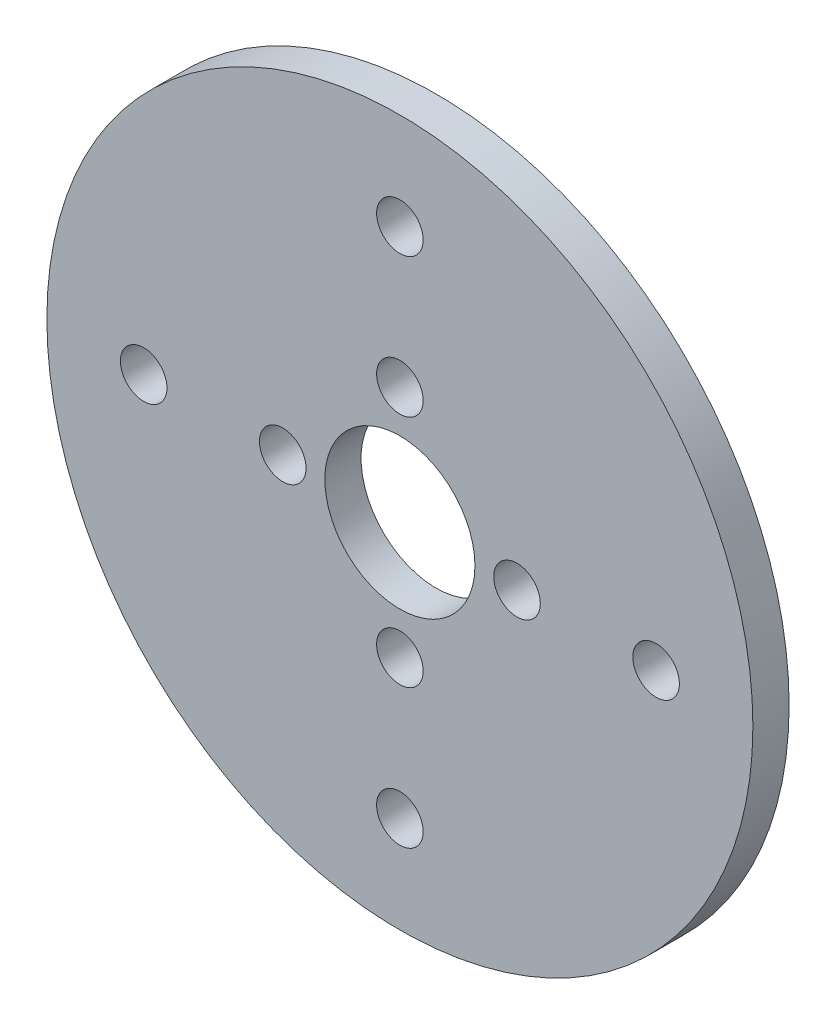
from build123d import *

# Parameters (mm, degrees)
SKETCH1_R           = 34.1
BOSS_EXTRUDE1_DEPTH = 1.75
SKETCH3_R           = 2.25
CUT_EXTRUDE2_DEPTH  = 49.351525312
SKETCH2_R           = 7.25
CUT_EXTRUDE1_DEPTH  = 49.351525312


with BuildPart() as part:
    # Sketch1 → Boss-Extrude1 (new, symmetric)
    with BuildSketch(Plane.XY):
        Circle(SKETCH1_R)
    extrude(amount=BOSS_EXTRUDE1_DEPTH, both=True)

    # Sketch3 → Cut-Extrude2 (cut, through all)
    with BuildSketch(Plane.XY.offset(1.75)):
        with Locations((0, 24.75)):
            Circle(SKETCH3_R)
        with Locations((0, 11.3137085)):
            Circle(SKETCH3_R)
        with Locations((24.75, 0)):
            Circle(SKETCH3_R)
        with Locations((11.3137085, 0)):
            Circle(SKETCH3_R)
        with Locations((0, -24.75)):
            Circle(SKETCH3_R)
        with Locations((0, -11.3137085)):
            Circle(SKETCH3_R)
        with Locations((-24.75, 0)):
            Circle(SKETCH3_R)
        with Locations((-11.3137085, 0)):
            Circle(SKETCH3_R)
    extrude(amount=-CUT_EXTRUDE2_DEPTH, mode=Mode.SUBTRACT)

    # Sketch2 → Cut-Extrude1 (cut, through all)
    with BuildSketch(Plane.XY.offset(1.75)):
        Circle(SKETCH2_R)
    extrude(amount=-CUT_EXTRUDE1_DEPTH, mode=Mode.SUBTRACT)


solid = part.part
